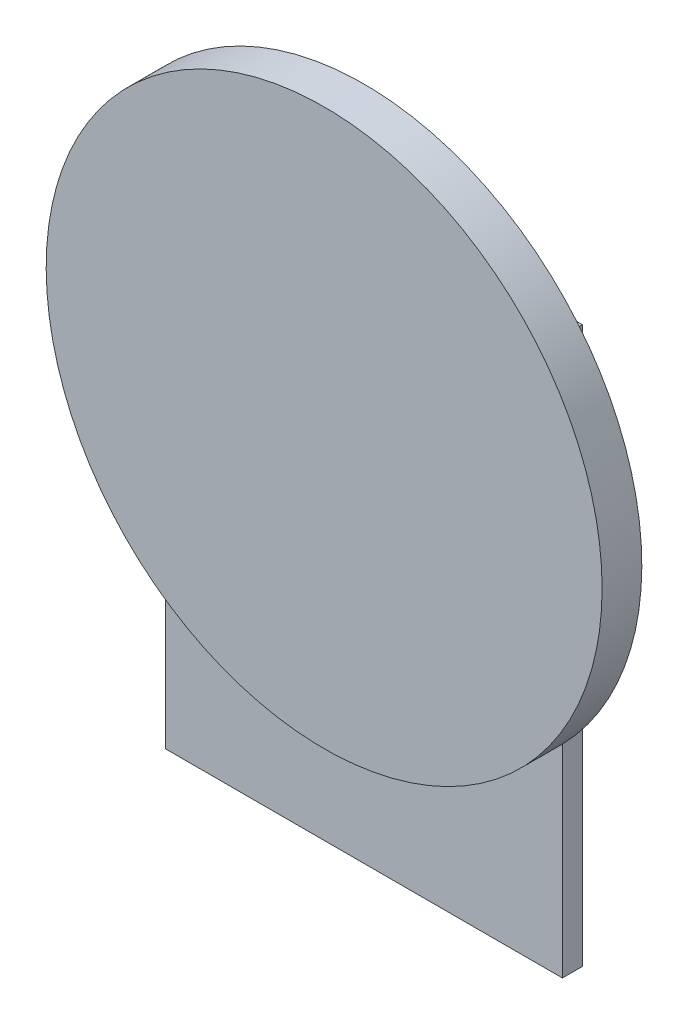
from build123d import *

# Parameters (mm, degrees)
SKETCH1_R           = 7
BOSS_EXTRUDE1_DEPTH = 1
SKETCH2_W           = 10
SKETCH2_H           = 14
BOSS_EXTRUDE2_DEPTH = 0.5


with BuildPart() as part:
    # Sketch1 → Boss-Extrude1 (new body)
    with BuildSketch(Plane.XY):
        Circle(SKETCH1_R)
    extrude(amount=BOSS_EXTRUDE1_DEPTH)

    # Sketch2 → Boss-Extrude2 (add)
    with BuildSketch(Plane(origin=(0, 0, 0), x_dir=(-1, 0, 0), z_dir=(0, 0, -1))):
        with Locations((0, -3)):
            Rectangle(SKETCH2_W, SKETCH2_H)
    extrude(amount=BOSS_EXTRUDE2_DEPTH)


solid = part.part
